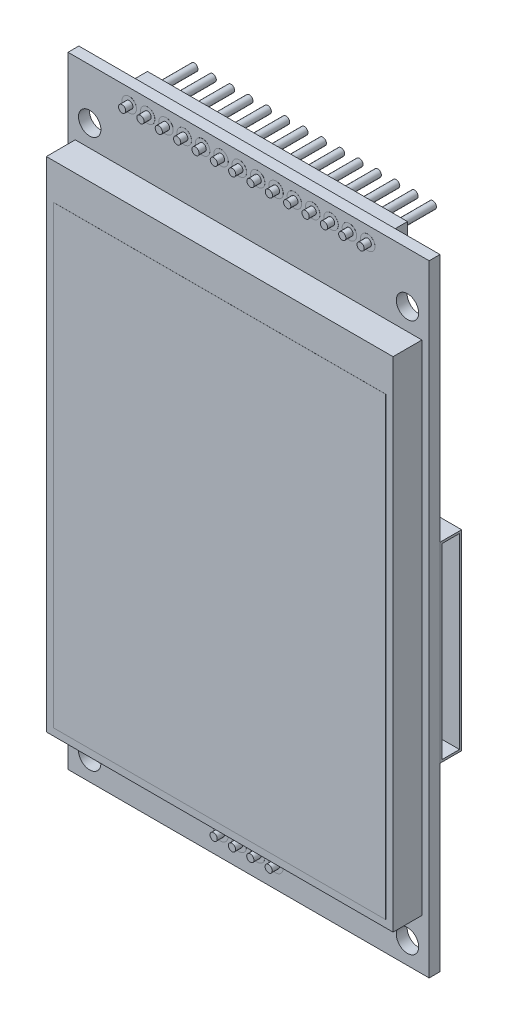
from build123d import *

# Parameters (mm, degrees)
SKETCH1_W                = 50
SKETCH1_H                = 86
BOSS_EXTRUDE1_DEPTH      = 1.5
SKETCH2_R                = 1.55
CUT_EXTRUDE1_DEPTH       = 1.5
SKETCH3_W                = 48
SKETCH3_H                = 69
BOSS_EXTRUDE2_DEPTH      = 4
SKETCH4_W                = 46
SKETCH4_H                = 63
BOSS_EXTRUDE3_DEPTH      = 0.01
SKETCH5_R                = 1
BOSS_EXTRUDE4_DEPTH      = 0.01
BOSS_EXTRUDE5_DEPTH      = 1
BOSS_EXTRUDE5_DEPTH_BACK = 9
SKETCH6_R                = 0.5
SKETCH8_W                = 36
SKETCH8_H                = 2.5
SKETCH8_W_2              = 11
BOSS_EXTRUDE6_DEPTH      = 2.5
BOSS_EXTRUDE7_DEPTH      = 3
SKETCH10_W               = 2.4
SKETCH10_H               = 25.9
CUT_EXTRUDE2_DEPTH       = 4


with BuildPart() as part:
    # Sketch1 → Boss-Extrude1 (new body)
    with BuildSketch(Plane.XY):
        with Locations((25, 43)):
            Rectangle(SKETCH1_W, SKETCH1_H)
    extrude(amount=BOSS_EXTRUDE1_DEPTH)

    # Sketch2 → Cut-Extrude1 (cut)
    with BuildSketch(Plane.XY.offset(1.5)):
        with Locations((3, 79)):
            Circle(SKETCH2_R)
        with Locations((47, 79)):
            Circle(SKETCH2_R)
        with Locations((47, 3)):
            Circle(SKETCH2_R)
        with Locations((3, 3)):
            Circle(SKETCH2_R)
    extrude(amount=-CUT_EXTRUDE1_DEPTH, mode=Mode.SUBTRACT)

    # Sketch3 → Boss-Extrude2 (add)
    with BuildSketch(Plane.XY.offset(1.5)):
        with Locations((25, 41.5)):
            Rectangle(SKETCH3_W, SKETCH3_H)
    extrude(amount=BOSS_EXTRUDE2_DEPTH)

    # Sketch4 → Boss-Extrude3 (add)
    with BuildSketch(Plane.XY.offset(5.5)):
        with Locations((25, 39.5)):
            Rectangle(SKETCH4_W, SKETCH4_H)
    extrude(amount=BOSS_EXTRUDE3_DEPTH)

    # Sketch5 → Boss-Extrude4 (add)
    with BuildSketch(Plane.XY.offset(1.5)):
        with Locations(Location((8.49, 83.96, 0), (0, 0, 180))):
            Circle(SKETCH5_R)
        with Locations(Location((11.03, 83.96, 0), (0, 0, 180))):
            Circle(SKETCH5_R)
        with Locations(Location((13.57, 83.96, 0), (0, 0, 180))):
            Circle(SKETCH5_R)
        with Locations(Location((16.11, 83.96, 0), (0, 0, 180))):
            Circle(SKETCH5_R)
        with Locations(Location((18.65, 83.96, 0), (0, 0, 180))):
            Circle(SKETCH5_R)
        with Locations(Location((21.19, 83.96, 0), (0, 0, 180))):
            Circle(SKETCH5_R)
        with Locations(Location((23.73, 83.96, 0), (0, 0, 180))):
            Circle(SKETCH5_R)
        with Locations(Location((26.27, 83.96, 0), (0, 0, 180))):
            Circle(SKETCH5_R)
        with Locations(Location((28.81, 83.96, 0), (0, 0, 180))):
            Circle(SKETCH5_R)
        with Locations(Location((31.35, 83.96, 0), (0, 0, 180))):
            Circle(SKETCH5_R)
        with Locations(Location((33.89, 83.96, 0), (0, 0, 180))):
            Circle(SKETCH5_R)
        with Locations(Location((36.43, 83.96, 0), (0, 0, 180))):
            Circle(SKETCH5_R)
        with Locations(Location((38.97, 83.96, 0), (0, 0, 180))):
            Circle(SKETCH5_R)
        with Locations(Location((41.51, 83.96, 0), (0, 0, 180))):
            Circle(SKETCH5_R)
        with Locations(Location((21.16020318, 3.000326514, 0), (0, 0, 180))):
            Circle(SKETCH5_R)
        with Locations(Location((23.70020318, 3.000326514, 0), (0, 0, 180))):
            Circle(SKETCH5_R)
        with Locations(Location((26.24020318, 3.000326514, 0), (0, 0, 180))):
            Circle(SKETCH5_R)
        with Locations(Location((28.78020318, 3.000326514, 0), (0, 0, 180))):
            Circle(SKETCH5_R)
    extrude(amount=BOSS_EXTRUDE4_DEPTH)

    # Sketch6 → Boss-Extrude5 (add, two sides: drawn at the far end of the back side and taken through both)
    with BuildSketch(Plane.XY.offset(1.5).offset(-BOSS_EXTRUDE5_DEPTH_BACK)):
        with Locations((8.49, 83.96)):
            Circle(SKETCH6_R)
        with Locations((11.03, 83.96)):
            Circle(SKETCH6_R)
        with Locations((13.57, 83.96)):
            Circle(SKETCH6_R)
        with Locations((16.11, 83.96)):
            Circle(SKETCH6_R)
        with Locations((18.65, 83.96)):
            Circle(SKETCH6_R)
        with Locations((21.19, 83.96)):
            Circle(SKETCH6_R)
        with Locations((23.73, 83.96)):
            Circle(SKETCH6_R)
        with Locations((26.27, 83.96)):
            Circle(SKETCH6_R)
        with Locations((28.81, 83.96)):
            Circle(SKETCH6_R)
        with Locations((31.35, 83.96)):
            Circle(SKETCH6_R)
        with Locations((33.89, 83.96)):
            Circle(SKETCH6_R)
        with Locations((36.43, 83.96)):
            Circle(SKETCH6_R)
        with Locations((38.97, 83.96)):
            Circle(SKETCH6_R)
        with Locations((41.51, 83.96)):
            Circle(SKETCH6_R)
        with Locations((21.16020318, 3.000326514)):
            Circle(SKETCH6_R)
        with Locations((23.70020318, 3.000326514)):
            Circle(SKETCH6_R)
        with Locations((26.24020318, 3.000326514)):
            Circle(SKETCH6_R)
        with Locations((28.78020318, 3.000326514)):
            Circle(SKETCH6_R)
    extrude(amount=BOSS_EXTRUDE5_DEPTH + BOSS_EXTRUDE5_DEPTH_BACK)

    # Sketch8 → Boss-Extrude6 (add)
    with BuildSketch(Plane(origin=(0, 0, 0), x_dir=(-1, 0, 0), z_dir=(0, 0, -1))):
        with Locations((-25, 83.95)):
            Rectangle(SKETCH8_W, SKETCH8_H)
        with Locations((-25, 3.05)):
            Rectangle(SKETCH8_W_2, SKETCH8_H)
    extrude(amount=BOSS_EXTRUDE6_DEPTH)


with BuildPart() as body_2:
    # Sketch9 → Boss-Extrude7 (new body)
    with BuildSketch(Plane(origin=(0, 0, 0), x_dir=(-1, 0, 0), z_dir=(0, 0, -1))):
        Polygon((-38.5, 51.5), (-50, 51.5), (-50, 25), (-45.736067977, 25), (-43.5, 27), (-38.5, 27), align=None)
    extrude(amount=BOSS_EXTRUDE7_DEPTH)

    # Sketch10 → Cut-Extrude2 (cut)
    with BuildSketch(Plane(origin=(50, 0, 0), x_dir=(0, 0, -1), z_dir=(1, 0, 0))):
        with Locations((1.5, 38.25)):
            Rectangle(SKETCH10_W, SKETCH10_H)
    extrude(amount=-CUT_EXTRUDE2_DEPTH, mode=Mode.SUBTRACT)


solid = Compound([part.part, body_2.part])
